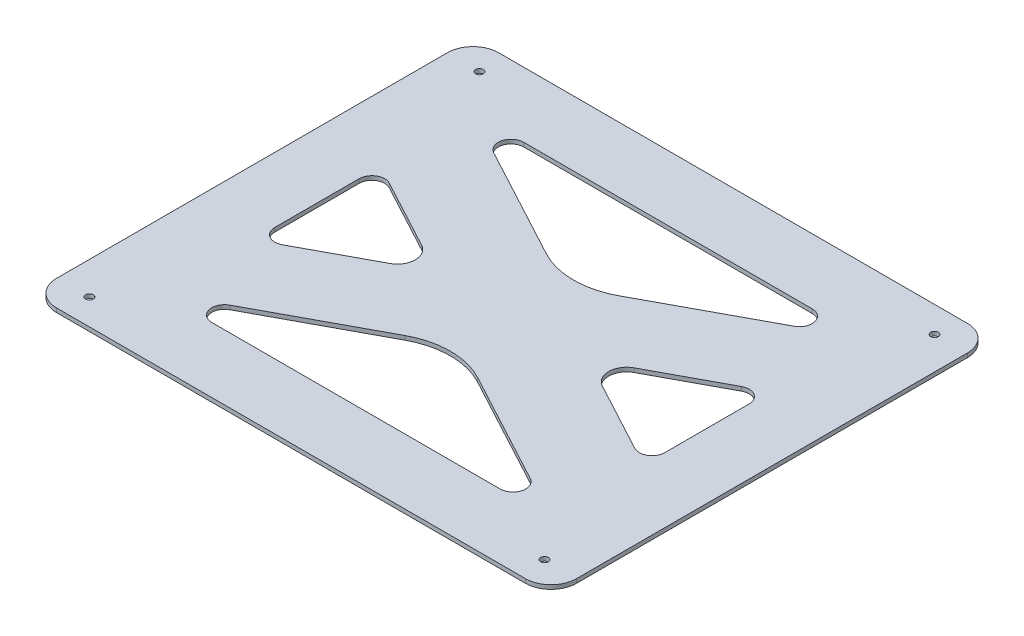
from build123d import *

# Parameters (mm, degrees)
SKETCH1_W           = 203.2
SKETCH1_H           = 172.72
BOSS_EXTRUDE1_DEPTH = 1.5875
CUT_EXTRUDE1_DEPTH  = 1.5875
SKETCH3_R           = 1.5
CUT_EXTRUDE2_DEPTH  = 1.5875
FILLET1_R           = 10


with BuildPart() as part:
    # Sketch1 → Boss-Extrude1 (new body)
    with BuildSketch(Plane(origin=(0, 0, 0), x_dir=(1, 0, 0), z_dir=(0, 1, 0))):
        Rectangle(SKETCH1_W, SKETCH1_H)
    extrude(amount=BOSS_EXTRUDE1_DEPTH)

    # Sketch2 → Cut-Extrude1 (cut)
    with BuildSketch(Plane(origin=(0, 1.5875, 0), x_dir=(1, 0, 0), z_dir=(0, 1, 0))):
        with BuildLine():
            Line((-56.337811401, 60.96), (56.337811401, 60.96))
            ThreePointArc((56.337811401, 60.96), (61.186538483, 57.180592348), (58.70513907, 51.555938272))
            Line((58.70513907, 51.555938272), (14.203966015, 27.635097742))
            ThreePointArc((14.203966015, 27.635097742), (0, 24.059468112), (-14.203966015, 27.635097742))
            Line((-14.203966015, 27.635097742), (-58.70513907, 51.555938272))
            ThreePointArc((-58.70513907, 51.555938272), (-61.186538483, 57.180592348), (-56.337811401, 60.96))
        make_face()
        with BuildLine():
            Line((-56.337811401, -60.96), (56.337811401, -60.96))
            ThreePointArc((56.337811401, -60.96), (61.186538483, -57.180592348), (58.70513907, -51.555938272))
            Line((58.70513907, -51.555938272), (14.203966015, -27.635097742))
            ThreePointArc((14.203966015, -27.635097742), (0, -24.059468112), (-14.203966015, -27.635097742))
            Line((-14.203966015, -27.635097742), (-58.70513907, -51.555938272))
            ThreePointArc((-58.70513907, -51.555938272), (-61.186538483, -57.180592348), (-56.337811401, -60.96))
        make_face()
        with BuildLine():
            Line((-68.832672331, 20.873835416), (-41.470344365, 6.16568642))
            ThreePointArc((-41.470344365, 6.16568642), (-37.784603101, 0), (-41.470344365, -6.16568642))
            Line((-41.470344365, -6.16568642), (-68.832672331, -20.873835416))
            ThreePointArc((-68.832672331, -20.873835416), (-73.765478674, -20.761430614), (-76.2, -16.469773687))
            Line((-76.2, -16.469773687), (-76.2, 16.469773687))
            ThreePointArc((-76.2, 16.469773687), (-73.765478674, 20.761430614), (-68.832672331, 20.873835416))
        make_face()
        with BuildLine():
            Line((41.470344365, 6.16568642), (68.832672331, 20.873835416))
            ThreePointArc((68.832672331, 20.873835416), (73.765478674, 20.761430614), (76.2, 16.469773687))
            Line((76.2, 16.469773687), (76.2, -16.469773687))
            ThreePointArc((76.2, -16.469773687), (73.765478674, -20.761430614), (68.832672331, -20.873835416))
            Line((68.832672331, -20.873835416), (41.470344365, -6.16568642))
            ThreePointArc((41.470344365, -6.16568642), (37.784603101, 0), (41.470344365, 6.16568642))
        make_face()
    extrude(amount=-CUT_EXTRUDE1_DEPTH, mode=Mode.SUBTRACT)

    # Sketch3 → Cut-Extrude2 (cut)
    with BuildSketch(Plane(origin=(0, 1.5875, 0), x_dir=(1, 0, 0), z_dir=(0, 1, 0))):
        with Locations(Location((-88.9, 76.2, 0), (0, 0, 270))):
            Circle(SKETCH3_R)
        with Locations(Location((88.9, 76.2, 0), (0, 0, 270))):
            Circle(SKETCH3_R)
        with Locations(Location((88.9, -76.2, 0), (0, 0, 270))):
            Circle(SKETCH3_R)
        with Locations(Location((-88.9, -76.2, 0), (0, 0, 270))):
            Circle(SKETCH3_R)
    extrude(amount=-CUT_EXTRUDE2_DEPTH, mode=Mode.SUBTRACT)

    # Fillet1
    fillet1_edges = [part.edges().sort_by_distance(p)[0] for p in [
        (101.6, 0.79375, 86.36),
        (-101.6, 0.79375, 86.36),
        (-101.6, 0.79375, -86.36),
        (101.6, 0.79375, -86.36),
    ]]
    fillet(fillet1_edges, radius=FILLET1_R)


solid = part.part
